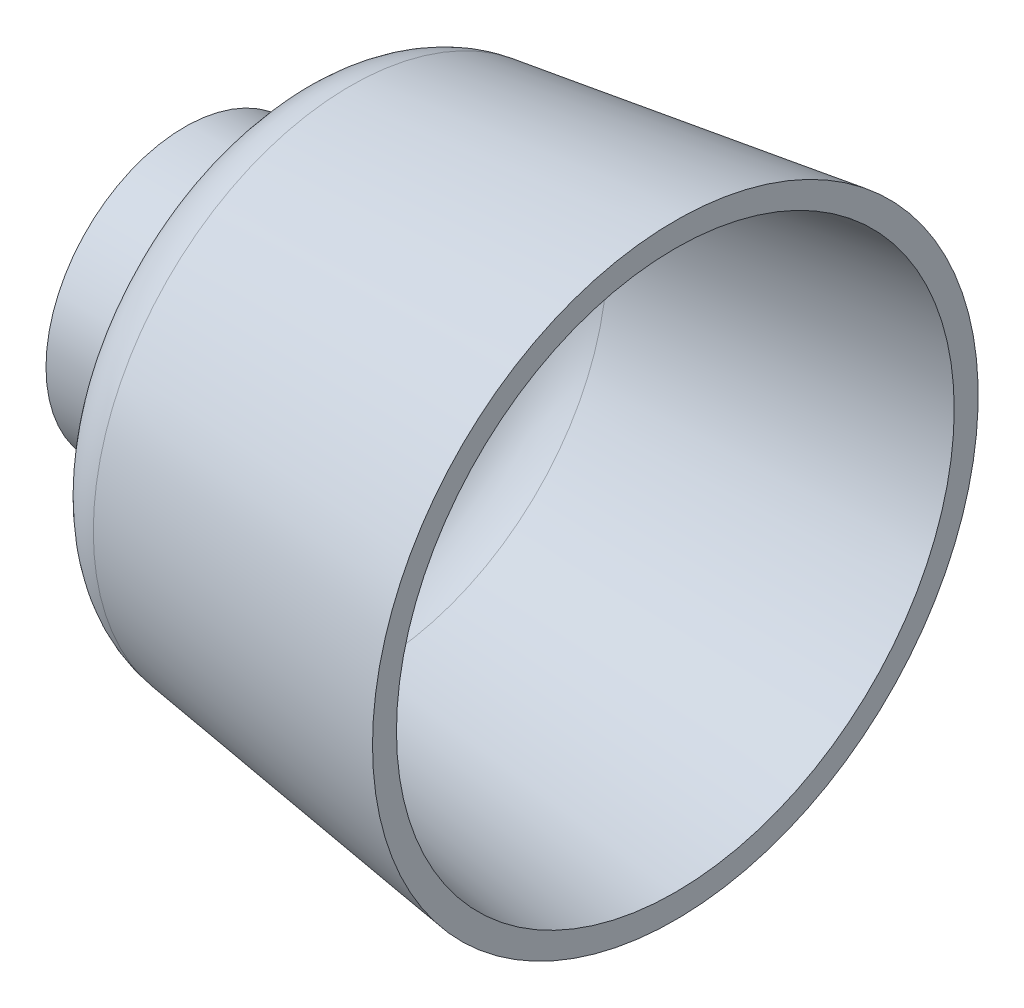
from build123d import *

# Parameters (mm, degrees)
TAPPED_HOLE_FOR_9_16_12_HELICOIL1_D     = 14.68374
TAPPED_HOLE_FOR_9_16_12_HELICOIL1_DEPTH = 26.924
TAPPED_HOLE_FOR_9_16_12_HELICOIL1_TIP   = 4.411440553
FILLET1_R                               = 4.7625


with BuildPart() as part:
    # Sketch1 → Revolve1 (revolve)
    with BuildSketch(Plane.XY, mode=Mode.PRIVATE) as revolve1_sk:
        Polygon((0, 9.27608), (6.35, 9.27608), (7.662583372, 16.720110216), (32.815392318, 20.255106981), (32.815392318, 18.652005709), (9.025682257, 15.30858), (7.682070664, 7.68858), (7.682070664, 0), (0, 0), (0, 7.68858), align=None)
    revolve(revolve1_sk.sketch.rotate(Axis((0, 0, 0), (1, 0, 0)), 90), axis=Axis((0, 0, 0), (1, 0, 0)))

    # Tapped Hole for 9/16-12 Helicoil1
    with Locations(Plane.ZY):
        with Locations((0, 0)):
            Hole(TAPPED_HOLE_FOR_9_16_12_HELICOIL1_D / 2, depth=TAPPED_HOLE_FOR_9_16_12_HELICOIL1_DEPTH)
            with Locations((0, 0, -(TAPPED_HOLE_FOR_9_16_12_HELICOIL1_DEPTH + TAPPED_HOLE_FOR_9_16_12_HELICOIL1_TIP / 2))):  # 118° drill point
                Cone(0, TAPPED_HOLE_FOR_9_16_12_HELICOIL1_D / 2, TAPPED_HOLE_FOR_9_16_12_HELICOIL1_TIP, mode=Mode.SUBTRACT)

    # Fillet1
    fillet1_edges = [part.edges().sort_by_distance(p)[0] for p in [
        (9.025682257, 0, -15.30858),
        (7.662583372, 0, -16.720110216),
    ]]
    fillet(fillet1_edges, radius=FILLET1_R)


solid = part.part
